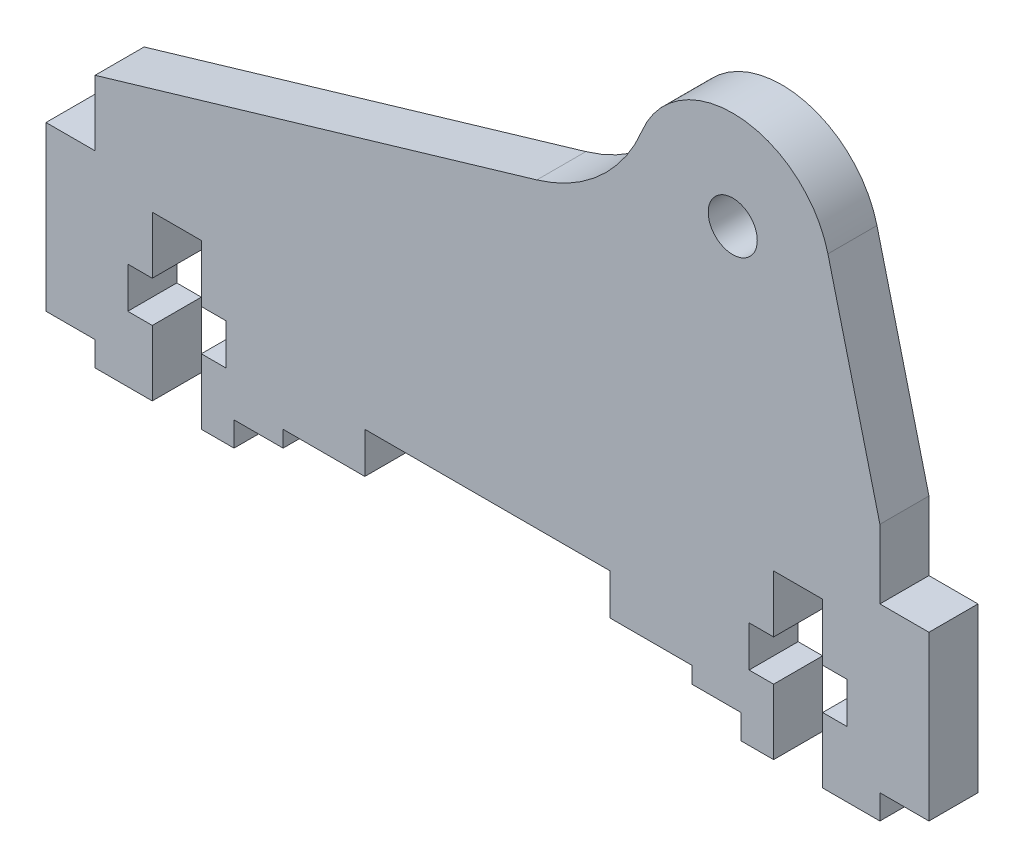
from build123d import *

# Parameters (mm, degrees)
ESQUISSE15_R        = 1.5
BOSS_EXTRU_15_DEPTH = 3


with BuildPart() as part:
    # Esquisse15 → Boss.-Extru.15 (new body)
    with BuildSketch(Plane.XY):
        with BuildLine():
            Line((209.424329445, 31.309985915), (211.424329445, 31.309985915))
            Line((211.424329445, 31.309985915), (211.424329445, 35.309985915))
            Line((211.424329445, 35.309985915), (209.924329445, 35.309985915))
            Line((209.924329445, 35.309985915), (209.924329445, 37.809985915))
            Line((209.924329445, 37.809985915), (211.424329445, 37.809985915))
            Line((211.424329445, 37.809985915), (211.424329445, 41.309985915))
            Line((211.424329445, 41.309985915), (214.424329445, 41.309985915))
            Line((214.424329445, 41.309985915), (214.424329445, 37.809985915))
            Line((214.424329445, 37.809985915), (215.924329445, 37.809985915))
            Line((215.924329445, 37.809985915), (215.924329445, 35.309985915))
            Line((215.924329445, 35.309985915), (214.424329445, 35.309985915))
            Line((214.424329445, 35.309985915), (214.424329445, 31.309985915))
            Line((214.424329445, 31.309985915), (217.924329445, 31.309985915))
            Line((217.924329445, 31.309985915), (217.924329445, 32.809985915))
            Line((217.924329445, 32.809985915), (220.924329445, 32.809985915))
            Line((220.924329445, 32.809985915), (220.924329445, 42.809985915))
            Line((220.924329445, 42.809985915), (217.924329445, 42.809985915))
            Line((217.924329445, 42.809985915), (217.924329445, 47.029043611))
            Line((217.924329445, 47.029043611), (214.745710446, 59.763094048))
            ThreePointArc((214.745710446, 59.763094048), (209.355265644, 64.294490405), (203.371200864, 60.582157334))
            ThreePointArc((203.371200864, 60.582157334), (200.818725519, 56.947971615), (196.944306758, 54.777415122))
            Line((196.944306758, 54.777415122), (169.924329445, 46.809985915))
            Line((169.924329445, 46.809985915), (169.924329445, 42.809985915))
            Line((169.924329445, 42.809985915), (166.924329445, 42.809985915))
            Line((166.924329445, 42.809985915), (166.924329445, 32.809985915))
            Line((166.924329445, 32.809985915), (169.924329445, 32.809985915))
            Line((169.924329445, 32.809985915), (169.924329445, 31.309985915))
            Line((169.924329445, 31.309985915), (173.424329445, 31.309985915))
            Line((173.424329445, 31.309985915), (173.424329445, 35.309985915))
            Line((173.424329445, 35.309985915), (171.924329445, 35.309985915))
            Line((171.924329445, 35.309985915), (171.924329445, 37.809985915))
            Line((171.924329445, 37.809985915), (173.424329445, 37.809985915))
            Line((173.424329445, 37.809985915), (173.424329445, 41.309985915))
            Line((173.424329445, 41.309985915), (176.424329445, 41.309985915))
            Line((176.424329445, 41.309985915), (176.424329445, 37.809985915))
            Line((176.424329445, 37.809985915), (177.924329445, 37.809985915))
            Line((177.924329445, 37.809985915), (177.924329445, 35.309985915))
            Line((177.924329445, 35.309985915), (176.424329445, 35.309985915))
            Line((176.424329445, 35.309985915), (176.424329445, 31.309985915))
            Line((176.424329445, 31.309985915), (178.424329445, 31.309985915))
            Line((178.424329445, 31.309985915), (178.424329445, 32.809985915))
            Line((178.424329445, 32.809985915), (181.424329445, 32.809985915))
            Line((181.424329445, 32.809985915), (181.424329445, 33.809985915))
            Line((181.424329445, 33.809985915), (186.424329445, 33.809985915))
            Line((186.424329445, 33.809985915), (186.424329445, 36.309985915))
            Line((186.424329445, 36.309985915), (201.424329445, 36.309985915))
            Line((201.424329445, 36.309985915), (201.424329445, 33.809985915))
            Line((201.424329445, 33.809985915), (206.424329445, 33.809985915))
            Line((206.424329445, 33.809985915), (206.424329445, 32.809985915))
            Line((206.424329445, 32.809985915), (209.424329445, 32.809985915))
            Line((209.424329445, 32.809985915), (209.424329445, 31.309985915))
        make_face()
        with Locations((208.924329445, 58.309985915)):
            Circle(ESQUISSE15_R, mode=Mode.SUBTRACT)
    extrude(amount=BOSS_EXTRU_15_DEPTH)


solid = part.part
